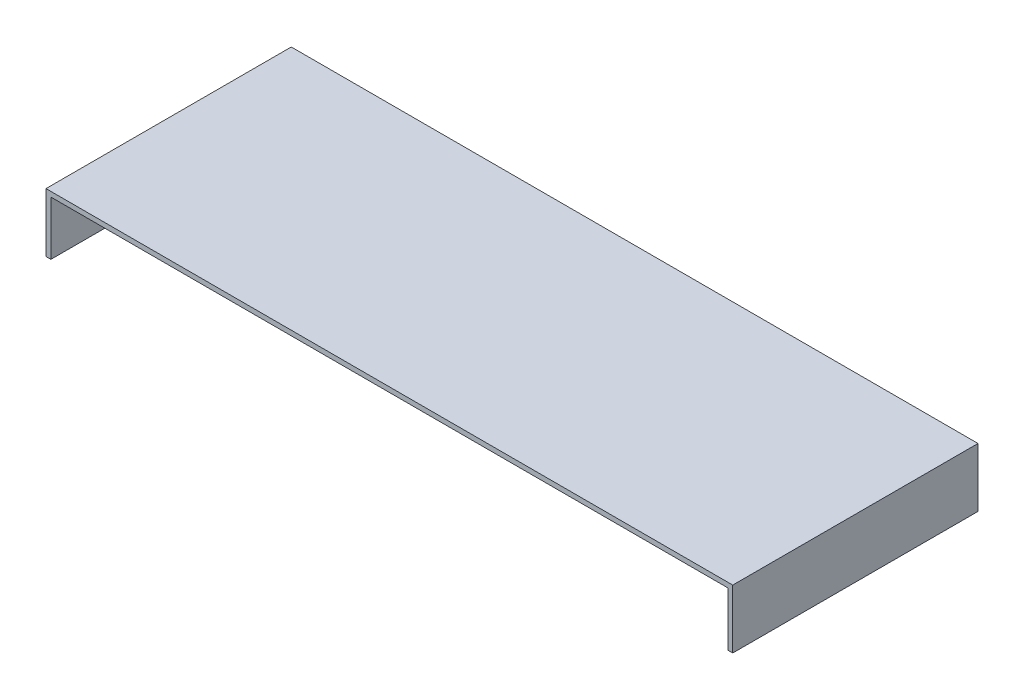
from build123d import *

# Parameters (mm, degrees)
SKETCH1_W           = 700
SKETCH1_H           = 250
BOSS_EXTRUDE1_DEPTH = 60
SHELL1_T            = -5
SKETCH3_W           = 690
SKETCH3_H           = 55
CUT_EXTRUDE1_DEPTH  = 435.281015012


with BuildPart() as part:
    # Sketch1 → Boss-Extrude1 (new body)
    with BuildSketch(Plane(origin=(0, 0, 0), x_dir=(1, 0, 0), z_dir=(0, 1, 0))):
        Rectangle(SKETCH1_W, SKETCH1_H)
    extrude(amount=BOSS_EXTRUDE1_DEPTH)

    # Shell1
    shell1_openings = [part.faces().sort_by_distance(p)[0] for p in [
        (0, 0, 0),
    ]]
    offset(amount=SHELL1_T, openings=shell1_openings, kind=Kind.INTERSECTION)

    # Sketch3 → Cut-Extrude1 (cut, through all)
    with BuildSketch(Plane.XY.offset(125)):
        with Locations((0, 27.5)):
            Rectangle(SKETCH3_W, SKETCH3_H)
    extrude(amount=-CUT_EXTRUDE1_DEPTH, mode=Mode.SUBTRACT)


solid = part.part
